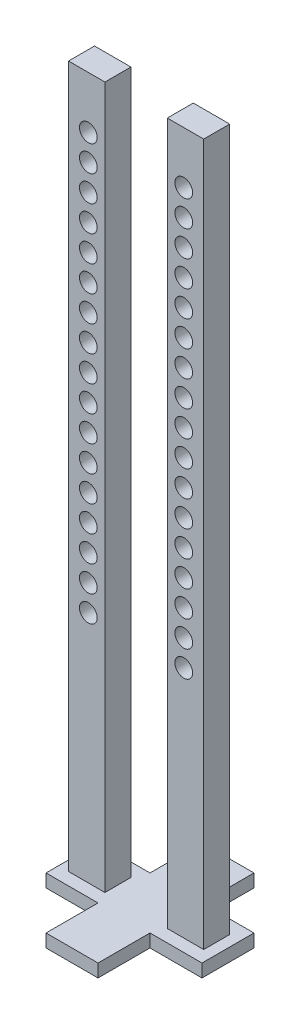
from build123d import *

# Parameters (mm, degrees)
BOSS_EXTRUDE1_DEPTH = 2.5
SKETCH3_W           = 7
SKETCH3_H           = 5
BOSS_EXTRUDE2_DEPTH = 135
SKETCH4_R           = 1.705
CUT_EXTRUDE1_DEPTH  = 5
LPATTERN1_COUNT     = 17
LPATTERN1_PITCH     = 5


with BuildPart() as part:
    # Sketch1 → Boss-Extrude1 (new body)
    with BuildSketch(Plane(origin=(0, 0, 0), x_dir=(1, 0, 0), z_dir=(0, 1, 0))):
        Polygon((4.210526316, 15), (-5.789473684, 15), (-5.789473684, 5), (-15.789473684, 5), (-15.789473684, -5), (-5.789473684, -5), (-5.789473684, -15), (4.210526316, -15), (4.210526316, -5), (14.210526316, -5), (14.210526316, 5), (4.210526316, 5), align=None)
    extrude(amount=-BOSS_EXTRUDE1_DEPTH)

    # Sketch3 → Boss-Extrude2 (add)
    with BuildSketch(Plane(origin=(0, 0, 0), x_dir=(1, 0, 0), z_dir=(0, 1, 0))):
        with Locations((-10.365258463, -0.095034863)):
            Rectangle(SKETCH3_W, SKETCH3_H)
        with Locations((8.634741537, -0.095034863)):
            Rectangle(SKETCH3_W, SKETCH3_H)
    extrude(amount=BOSS_EXTRUDE2_DEPTH)

    # Sketch4 → Cut-Extrude1 (cut, symmetric)
    with BuildSketch(Plane.XY):
        with Locations(Location((-10.0595209, 125, 0), (0, 0, 180))):
            Circle(SKETCH4_R)
        with Locations(Location((8.29517143, 125, 0), (0, 0, 180))):
            Circle(SKETCH4_R)
    cut_extrude1 = extrude(amount=CUT_EXTRUDE1_DEPTH, both=True, mode=Mode.SUBTRACT)

    # LPattern1: Cut-Extrude1 ×17
    with Locations(*[(0, -i * LPATTERN1_PITCH, 0) for i in range(1, LPATTERN1_COUNT)]):
        add(cut_extrude1, mode=Mode.SUBTRACT)


solid = part.part
